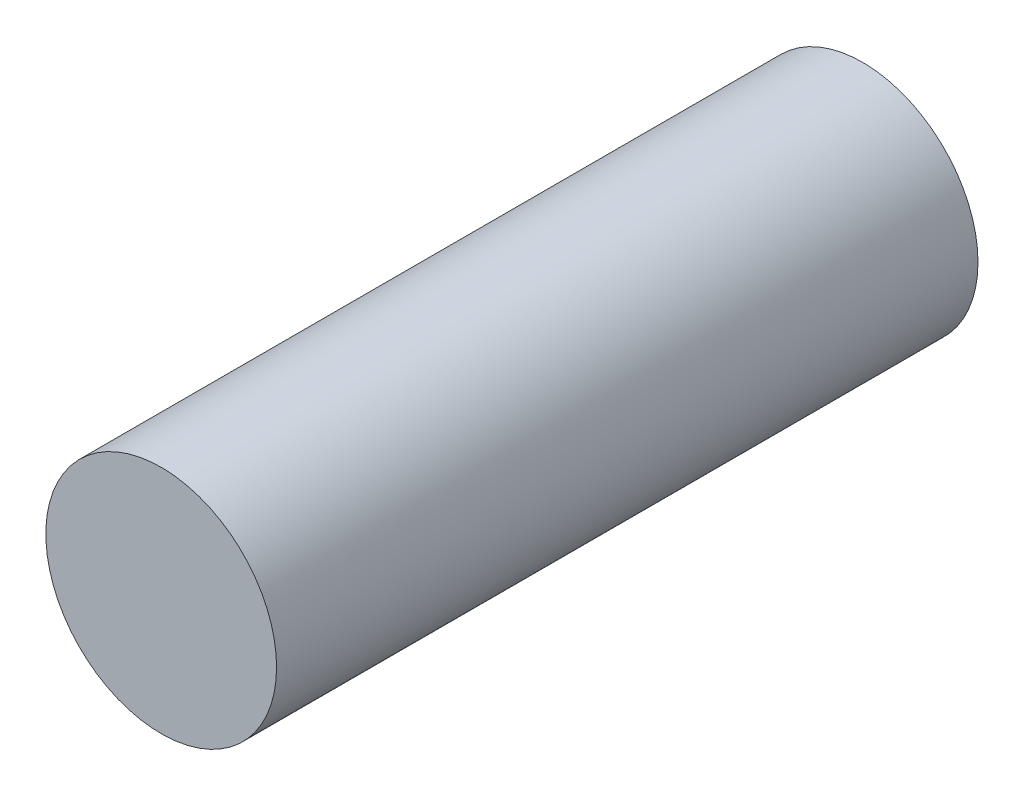
from build123d import *

# Parameters (mm, degrees)
SKETCH1_R           = 0.25
BOSS_EXTRUDE1_DEPTH = 0.76


with BuildPart() as part:
    # Sketch1 → Boss-Extrude1 (new, symmetric)
    with BuildSketch(Plane.XY):
        with Locations((-2.704368639, 8.386419333)):
            Circle(SKETCH1_R)
    extrude(amount=BOSS_EXTRUDE1_DEPTH, both=True)


solid = part.part
